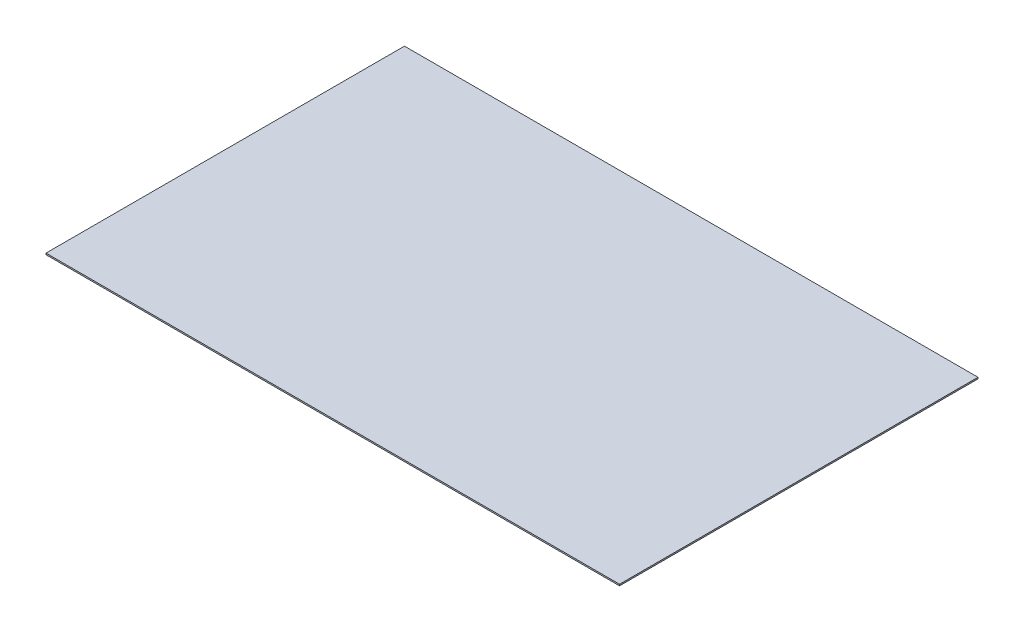
from build123d import *

# Parameters (mm, degrees)
SKETCH_1_W      = 4000
SKETCH_1_H      = 2500
EXTRUDE_1_DEPTH = 10


with BuildPart() as part:
    # 草圖1 → 填料-伸長1 (new body)
    with BuildSketch(Plane(origin=(0, 0, 0), x_dir=(1, 0, 0), z_dir=(0, 1, 0))):
        Rectangle(SKETCH_1_W, SKETCH_1_H)
    extrude(amount=EXTRUDE_1_DEPTH)


solid = part.part
